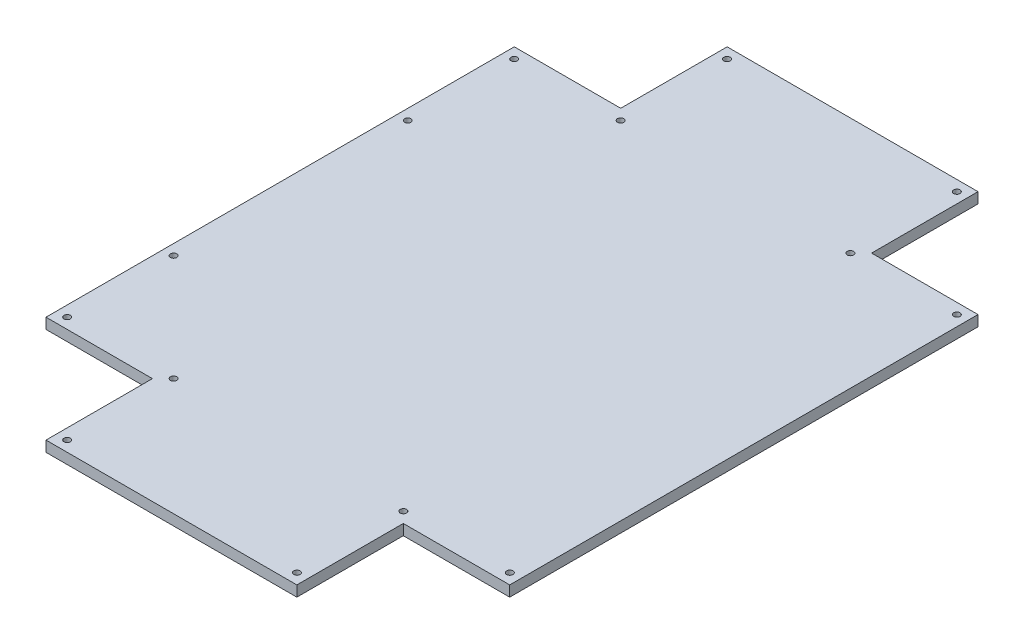
from build123d import *

# Parameters (mm, degrees)
ESQUISSE1_R        = 1.5
BOSS_EXTRU_1_DEPTH = 5


with BuildPart() as part:
    # Esquisse1 → Boss.-Extru.1 (new body)
    with BuildSketch(Plane(origin=(0, 0, 0), x_dir=(1, 0, 0), z_dir=(0, 1, 0))):
        Polygon((-58.927554829, 110), (-58.927554829, 160), (58.927554829, 160), (58.927554829, 110), (108.927554829, 110), (108.927554829, -110), (58.927554829, -110), (58.927554829, -160), (-58.927554829, -160), (-58.927554829, -110), (-108.927554829, -110), (-108.927554829, 0), (-108.927554829, 110), align=None)
        with Locations(Location((-103.976302336, -105, 0), (0, 0, 270))):
            Circle(ESQUISSE1_R, mode=Mode.SUBTRACT)
        with Locations(Location((-103.976302336, -55, 0), (0, 0, 270))):
            Circle(ESQUISSE1_R, mode=Mode.SUBTRACT)
        with Locations(Location((-53.976302336, -105, 0), (0, 0, 270))):
            Circle(ESQUISSE1_R, mode=Mode.SUBTRACT)
        with Locations(Location((-53.976302336, -155, 0), (0, 0, 270))):
            Circle(ESQUISSE1_R, mode=Mode.SUBTRACT)
        with Locations(Location((-53.976302336, 155, 0), (0, 0, 90))):
            Circle(ESQUISSE1_R, mode=Mode.SUBTRACT)
        with Locations(Location((-53.976302336, 105, 0), (0, 0, 90))):
            Circle(ESQUISSE1_R, mode=Mode.SUBTRACT)
        with Locations(Location((-103.976302336, 105, 0), (0, 0, 90))):
            Circle(ESQUISSE1_R, mode=Mode.SUBTRACT)
        with Locations(Location((-103.976302336, 55, 0), (0, 0, 90))):
            Circle(ESQUISSE1_R, mode=Mode.SUBTRACT)
        with Locations(Location((53.976302336, -155, 0), (0, 0, 90))):
            Circle(ESQUISSE1_R, mode=Mode.SUBTRACT)
        with Locations(Location((53.976302336, -105, 0), (0, 0, 90))):
            Circle(ESQUISSE1_R, mode=Mode.SUBTRACT)
        with Locations(Location((103.976302336, -105, 0), (0, 0, 90))):
            Circle(ESQUISSE1_R, mode=Mode.SUBTRACT)
        with Locations(Location((103.976302336, 105, 0), (0, 0, 270))):
            Circle(ESQUISSE1_R, mode=Mode.SUBTRACT)
        with Locations(Location((53.976302336, 105, 0), (0, 0, 270))):
            Circle(ESQUISSE1_R, mode=Mode.SUBTRACT)
        with Locations(Location((53.976302336, 155, 0), (0, 0, 270))):
            Circle(ESQUISSE1_R, mode=Mode.SUBTRACT)
    extrude(amount=BOSS_EXTRU_1_DEPTH)


solid = part.part
